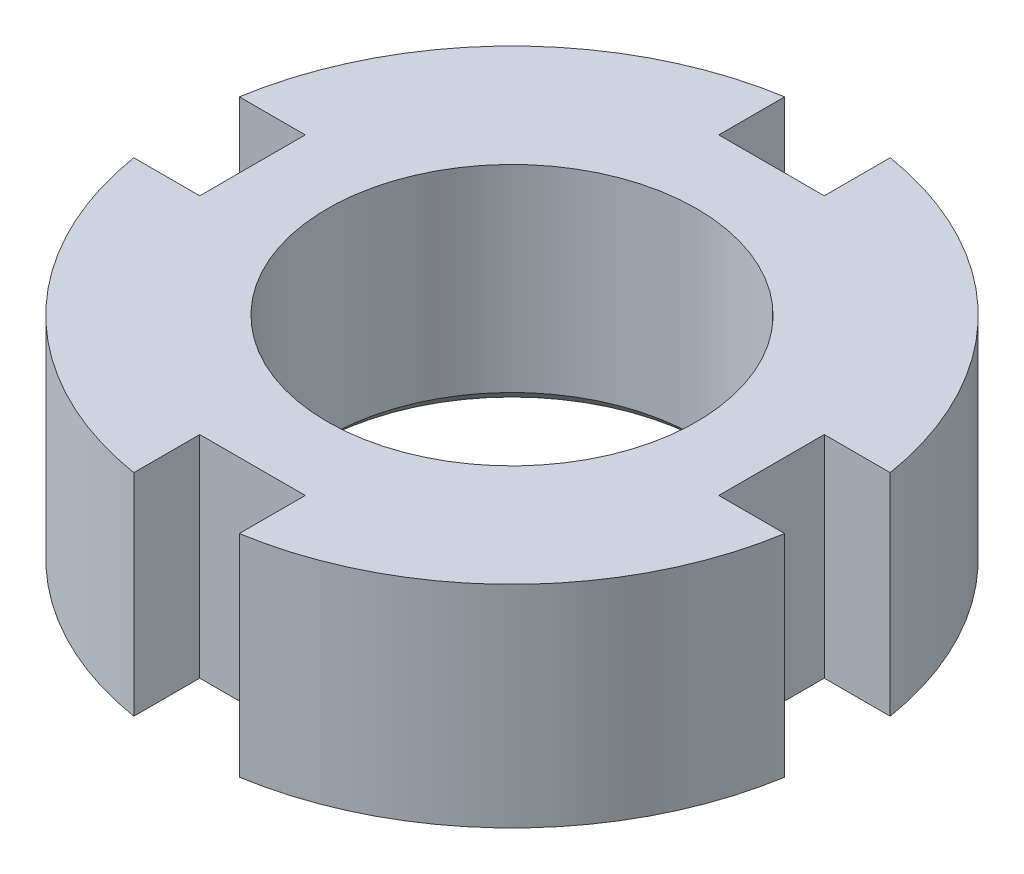
from build123d import *

# Parameters (mm, degrees)
BOSS_EXTRUDE1_DEPTH              = 8
M30X2_0_TAPPED_HOLE1_D           = 28
M30X2_0_TAPPED_HOLE1_DEPTH       = 16
M30X2_0_TAPPED_HOLE1_CSINK_D     = 30.05
M30X2_0_TAPPED_HOLE1_CSINK_ANGLE = 90
M30X2_0_TAPPED_HOLE1_TIP         = 8.412048666


with BuildPart() as part:
    # Sketch1 → Boss-Extrude1 (new, symmetric)
    with BuildSketch(Plane(origin=(0, 0, 0), x_dir=(1, 0, 0), z_dir=(0, 1, 0))):
        with BuildLine():
            Line((-4, -19.677925359), (-4, -24.677925359))
            ThreePointArc((-4, -24.677925359), (-17.67766953, -17.67766953), (-24.677925359, -4))
            Line((-24.677925359, -4), (-19.677925359, -4))
            Line((-19.677925359, -4), (-19.677925359, 4))
            Line((-19.677925359, 4), (-24.677925359, 4))
            ThreePointArc((-24.677925359, 4), (-17.67766953, 17.67766953), (-4, 24.677925359))
            Line((-4, 24.677925359), (-4, 19.677925359))
            Line((-4, 19.677925359), (4, 19.677925359))
            Line((4, 19.677925359), (4, 24.677925359))
            ThreePointArc((4, 24.677925359), (17.67766953, 17.67766953), (24.677925359, 4))
            Line((24.677925359, 4), (19.677925359, 4))
            Line((19.677925359, 4), (19.677925359, -4))
            Line((19.677925359, -4), (24.677925359, -4))
            ThreePointArc((24.677925359, -4), (17.67766953, -17.67766953), (4, -24.677925359))
            Line((4, -24.677925359), (4, -19.677925359))
            Line((4, -19.677925359), (-4, -19.677925359))
        make_face()
    extrude(amount=BOSS_EXTRUDE1_DEPTH, both=True)

    # M30x2.0 Tapped Hole1
    with Locations(Plane(origin=(0, -8, 0), x_dir=(-1, 0, 0), z_dir=(0, -1, 0))):
        with Locations((0, 0)):
            CounterSinkHole(M30X2_0_TAPPED_HOLE1_D / 2, M30X2_0_TAPPED_HOLE1_CSINK_D / 2, depth=M30X2_0_TAPPED_HOLE1_DEPTH, counter_sink_angle=M30X2_0_TAPPED_HOLE1_CSINK_ANGLE)
            with Locations((0, 0, -(M30X2_0_TAPPED_HOLE1_DEPTH + M30X2_0_TAPPED_HOLE1_TIP / 2))):  # 118° drill point
                Cone(0, M30X2_0_TAPPED_HOLE1_D / 2, M30X2_0_TAPPED_HOLE1_TIP, mode=Mode.SUBTRACT)


solid = part.part
